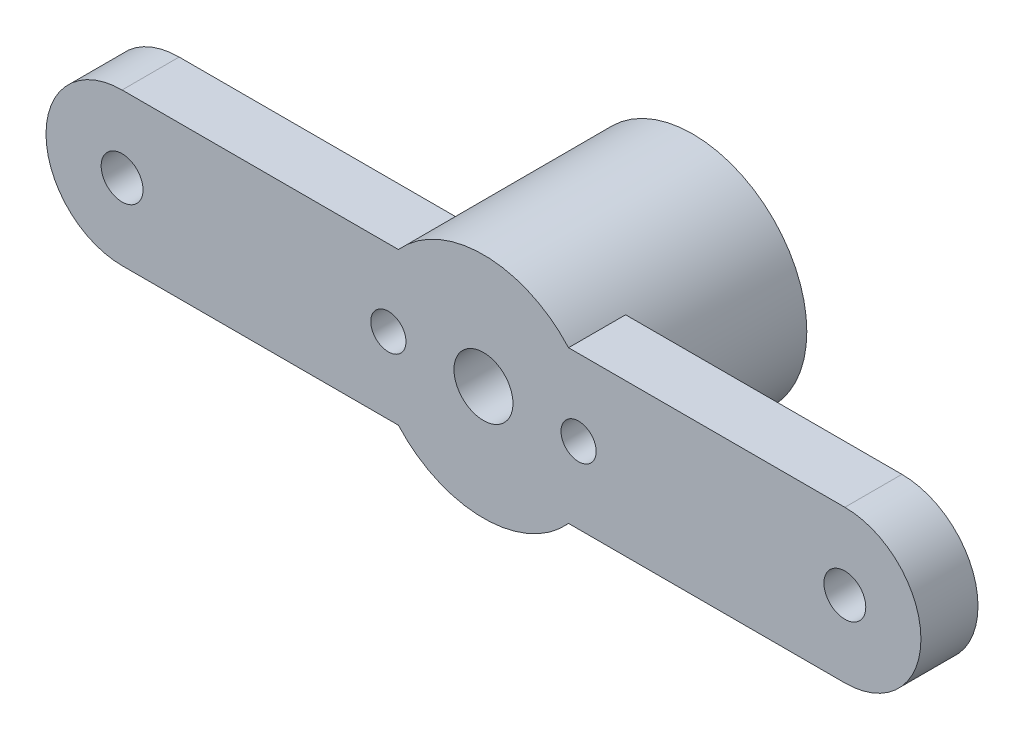
from build123d import *
from build123d.topology import SkipClean

# Parameters (mm, degrees)
SKETCH_1_R      = 1.55
SKETCH_1_R_2    = 1.1
SKETCH_1_R_3    = 0.925
EXTRUDE_1_DEPTH = 3
EXTRUDE_START   = 8
SKETCH_2_R      = 6
SKETCH_2_R_2    = 1.55
SKETCH_2_R_3    = 0.925
EXTRUDE_2_DEPTH = 8


with BuildPart() as part:
    # 草图1 → 凸台-拉伸1 (new body)
    with BuildSketch(Plane.XY):
        with BuildLine():
            Line((4.472135955, 4), (19, 4))
            ThreePointArc((19, 4), (23, 0), (19, -4))
            Line((19, -4), (4.472135955, -4))
            ThreePointArc((4.472135955, -4), (0, -6), (-4.472135955, -4))
            Line((-4.472135955, -4), (-19, -4))
            ThreePointArc((-19, -4), (-23, 0), (-19, 4))
            Line((-19, 4), (-4.472135955, 4))
            ThreePointArc((-4.472135955, 4), (0, 6), (4.472135955, 4))
        make_face()
        Circle(SKETCH_1_R, mode=Mode.SUBTRACT)
        with Locations((19, 0)):
            Circle(SKETCH_1_R_2, mode=Mode.SUBTRACT)
        with Locations((-19, 0)):
            Circle(SKETCH_1_R_2, mode=Mode.SUBTRACT)
        with Locations((-5, 0)):
            Circle(SKETCH_1_R_3, mode=Mode.SUBTRACT)
        with Locations((5, 0)):
            Circle(SKETCH_1_R_3, mode=Mode.SUBTRACT)
    extrude(amount=EXTRUDE_1_DEPTH)

    # 草图2 → 凸台-拉伸2 (add)
    with SkipClean():  # the faces are left unmerged after this step: merging them gives an invalid solid
        with BuildSketch(Plane(origin=(0, 0, 0), x_dir=(-1, 0, 0), z_dir=(0, 0, -1)).offset(EXTRUDE_START)):
            Circle(SKETCH_2_R)
            Circle(SKETCH_2_R_2, mode=Mode.SUBTRACT)
            with Locations((-5, 0)):
                Circle(SKETCH_2_R_3, mode=Mode.SUBTRACT)
            with Locations((5, 0)):
                Circle(SKETCH_2_R_3, mode=Mode.SUBTRACT)
        extrude(amount=-EXTRUDE_2_DEPTH)


solid = part.part
